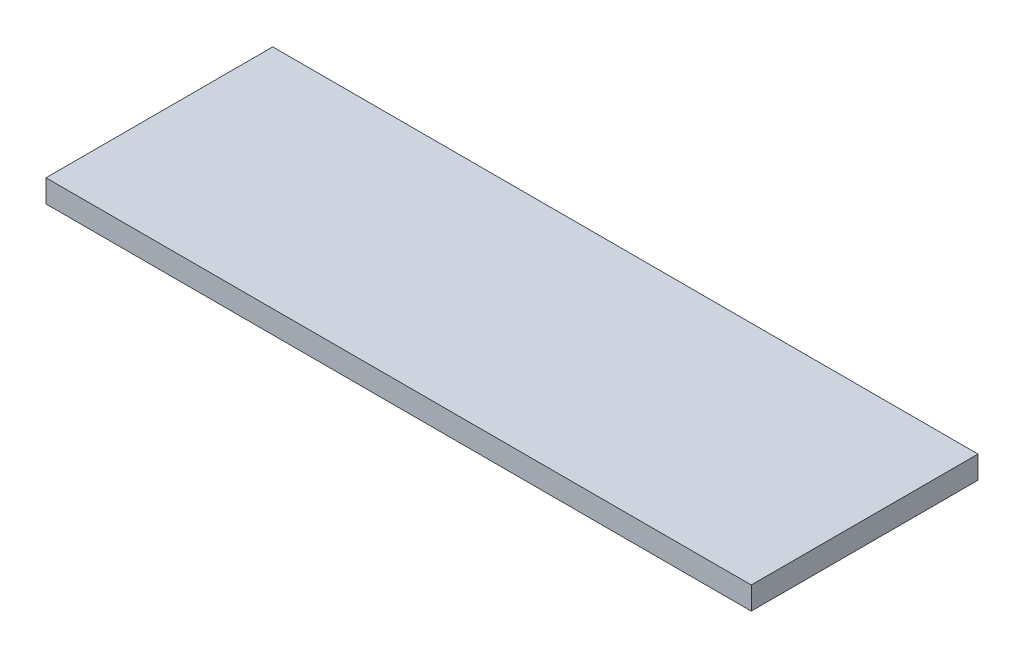
from build123d import *

# Parameters (mm, degrees)
SKETCH1_W           = 250
SKETCH1_H           = 40
BOSS_EXTRUDE1_DEPTH = 4
SKETCH2_W           = 144.143452794
SKETCH2_H           = 66.335420071
CUT_EXTRUDE1_DEPTH  = 10


with BuildPart() as part:
    # Sketch1 → Boss-Extrude1 (new body)
    with BuildSketch(Plane(origin=(0, 0, 0), x_dir=(1, 0, 0), z_dir=(0, 1, 0))):
        with Locations((-25.628547234, -36.520233304)):
            Rectangle(SKETCH1_W, SKETCH1_H)
    extrude(amount=BOSS_EXTRUDE1_DEPTH)

    # Sketch2 → Cut-Extrude1 (cut)
    with BuildSketch(Plane.XZ):
        with Locations((45.857682573, 49.68794334)):
            Rectangle(SKETCH2_W, SKETCH2_H)
    extrude(amount=-CUT_EXTRUDE1_DEPTH, mode=Mode.SUBTRACT)


solid = part.part
